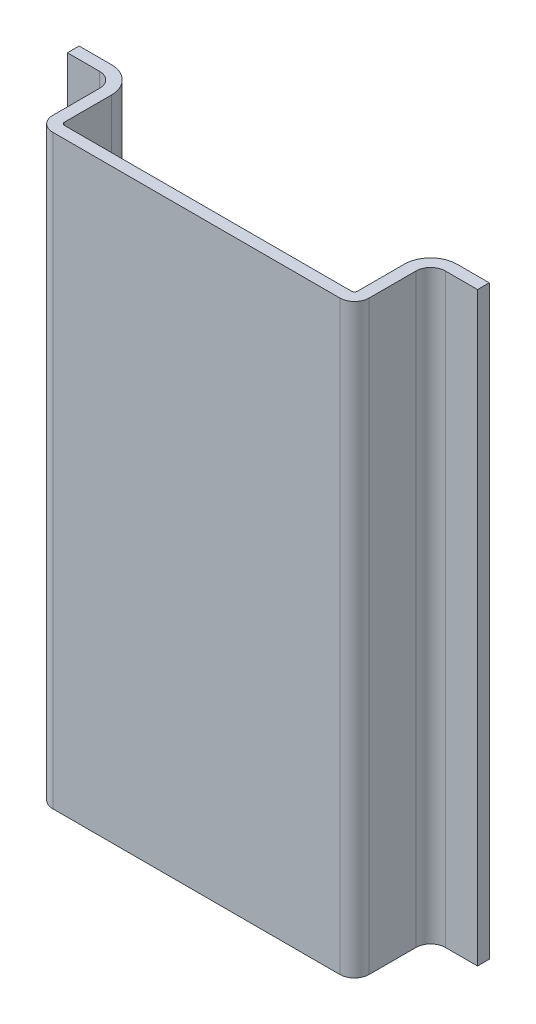
from build123d import *

# Parameters (mm, degrees)
OMEGA_TS_35_1_DEPTH = 50


with BuildPart() as part:
    # Sketch2 → Omega TS-35(1) (new body)
    with BuildSketch(Plane(origin=(0, 0, 0), x_dir=(1, 0, 0), z_dir=(0, 1, 0))):
        with BuildLine():
            Line((12.25, 0), (-12.25, 0))
            ThreePointArc((-12.25, 0), (-13.133883476, 0.366116524), (-13.5, 1.25))
            Line((-13.5, 1.25), (-13.5, 5.25))
            ThreePointArc((-13.5, 5.25), (-13.866116524, 6.133883476), (-14.75, 6.5))
            Line((-14.75, 6.5), (-17.5, 6.5))
            Line((-17.5, 6.5), (-17.5, 7.5))
            Line((-17.5, 7.5), (-14.75, 7.5))
            ThreePointArc((-14.75, 7.5), (-13.159009742, 6.840990258), (-12.5, 5.25))
            Line((-12.5, 5.25), (-12.5, 1.25))
            ThreePointArc((-12.5, 1.25), (-12.426776695, 1.073223305), (-12.25, 1))
            Line((-12.25, 1), (12.25, 1))
            ThreePointArc((12.25, 1), (12.426776695, 1.073223305), (12.5, 1.25))
            Line((12.5, 1.25), (12.5, 5.25))
            ThreePointArc((12.5, 5.25), (13.159009742, 6.840990258), (14.75, 7.5))
            Line((14.75, 7.5), (17.5, 7.5))
            Line((17.5, 7.5), (17.5, 6.5))
            Line((17.5, 6.5), (14.75, 6.5))
            ThreePointArc((14.75, 6.5), (13.866116524, 6.133883476), (13.5, 5.25))
            Line((13.5, 5.25), (13.5, 1.25))
            ThreePointArc((13.5, 1.25), (13.133883476, 0.366116524), (12.25, 0))
        make_face()
    extrude(amount=OMEGA_TS_35_1_DEPTH)


solid = part.part
